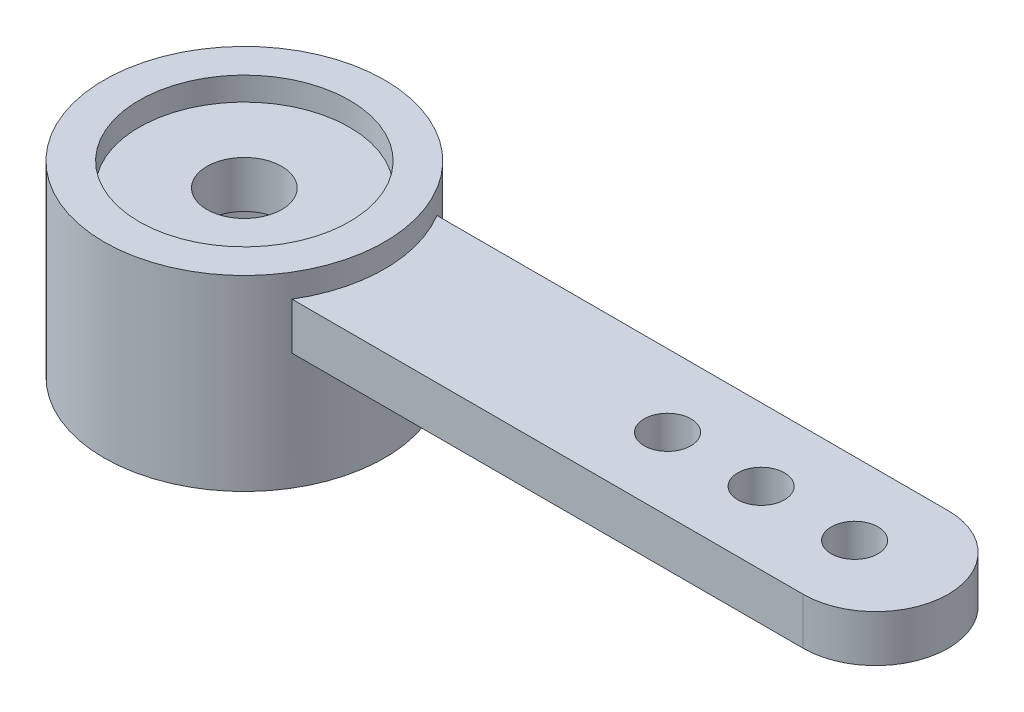
from build123d import *

# Parameters (mm, degrees)
SKETCH_1_R      = 2.25
EXTRUDE_1_DEPTH = 0.5
EXTRUDE_START   = -3.5
SKETCH_1_7_R    = 2.25
EXTRUDE_2_DEPTH = 3.5
EXTRUDE_START_2 = -1
SKETCH_1_8_R    = 0.5
SKETCH_1_8_R_2  = 2.25
SKETCH_1_8_R_3  = 0.8
EXTRUDE_3_DEPTH = 1


with BuildPart() as part:
    # 草图1 → 凸台-拉伸1 (new body)
    with BuildSketch(Plane(origin=(0, 0, 0), x_dir=(1, 0, 0), z_dir=(0, 1, 0))):
        with BuildLine():
            ThreePointArc((3, 0), (2.890221403, 0.804127004), (2.568919841, 1.549403386))
            ThreePointArc((2.568919841, 1.549403386), (-3, 0), (2.568919841, -1.549403386))
            ThreePointArc((2.568919841, -1.549403386), (2.890221403, -0.804127004), (3, 0))
        make_face()
        Circle(SKETCH_1_R, mode=Mode.SUBTRACT)
    extrude(amount=EXTRUDE_1_DEPTH)

    # 草图1<7> → 凸台-拉伸2 (add)
    with BuildSketch(Plane(origin=(0, 0, 0), x_dir=(1, 0, 0), z_dir=(0, 1, 0)).offset(EXTRUDE_START)):
        with BuildLine():
            ThreePointArc((3, 0), (2.890221403, 0.804127004), (2.568919841, 1.549403386))
            ThreePointArc((2.568919841, 1.549403386), (-3, 0), (2.568919841, -1.549403386))
            ThreePointArc((2.568919841, -1.549403386), (2.890221403, -0.804127004), (3, 0))
        make_face()
        Circle(SKETCH_1_7_R, mode=Mode.SUBTRACT)
    extrude(amount=EXTRUDE_2_DEPTH)

    # 草图1<8> → 凸台-拉伸3 (add)
    # profile 1 of 2: a face of its own
    with BuildSketch(Plane(origin=(0, 0, 0), x_dir=(1, 0, 0), z_dir=(0, 1, 0)).offset(EXTRUDE_START_2)):
        with BuildLine():
            ThreePointArc((13.5, -1.549403386), (15.049403386, 0), (13.5, 1.549403386))
            Line((13.5, 1.549403386), (2.568919841, 1.549403386))
            ThreePointArc((2.568919841, 1.549403386), (3, 0), (2.568919841, -1.549403386))
            Line((2.568919841, -1.549403386), (13.5, -1.549403386))
        make_face()
        with Locations((9.049403386, 0)):
            Circle(SKETCH_1_8_R, mode=Mode.SUBTRACT)
        with Locations((11.049403386, 0)):
            Circle(SKETCH_1_8_R, mode=Mode.SUBTRACT)
        with Locations((13.049403386, 0)):
            Circle(SKETCH_1_8_R, mode=Mode.SUBTRACT)
    # profile 2 of 2: a face of its own
    with BuildSketch(Plane(origin=(0, 0, 0), x_dir=(1, 0, 0), z_dir=(0, 1, 0)).offset(EXTRUDE_START_2)):
        Circle(SKETCH_1_8_R_2)
        Circle(SKETCH_1_8_R_3, mode=Mode.SUBTRACT)
    extrude(amount=EXTRUDE_3_DEPTH)


solid = part.part
